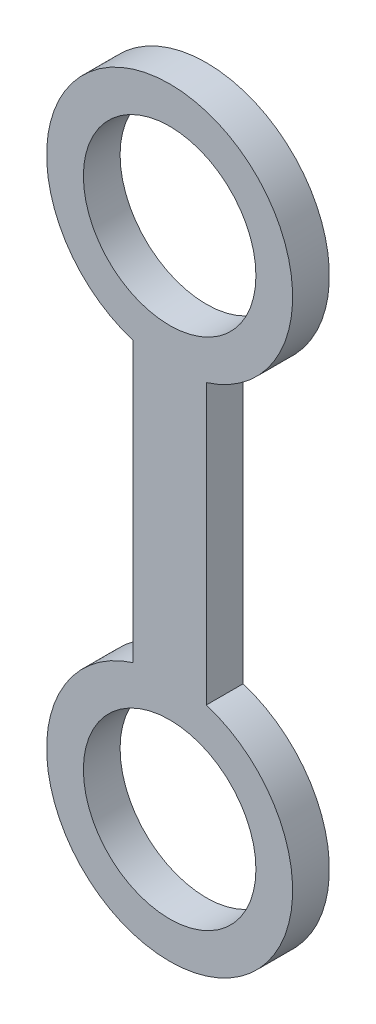
from build123d import *

# Parameters (mm, degrees)
ESQUISSE1_R        = 23.5
BOSS_EXTRU_1_DEPTH = 10


with BuildPart() as part:
    # Esquisse1 → Boss.-Extru.1 (new body)
    with BuildSketch(Plane.XY):
        with BuildLine():
            Line((-10, 108.027355443), (-10, 31.972644557))
            ThreePointArc((-10, 31.972644557), (0, -33.5), (10, 31.972644557))
            Line((10, 31.972644557), (10, 108.027355443))
            ThreePointArc((10, 108.027355443), (0, 173.5), (-10, 108.027355443))
        make_face()
        Circle(ESQUISSE1_R, mode=Mode.SUBTRACT)
        with Locations((0, 140)):
            Circle(ESQUISSE1_R, mode=Mode.SUBTRACT)
    extrude(amount=BOSS_EXTRU_1_DEPTH)


solid = part.part
